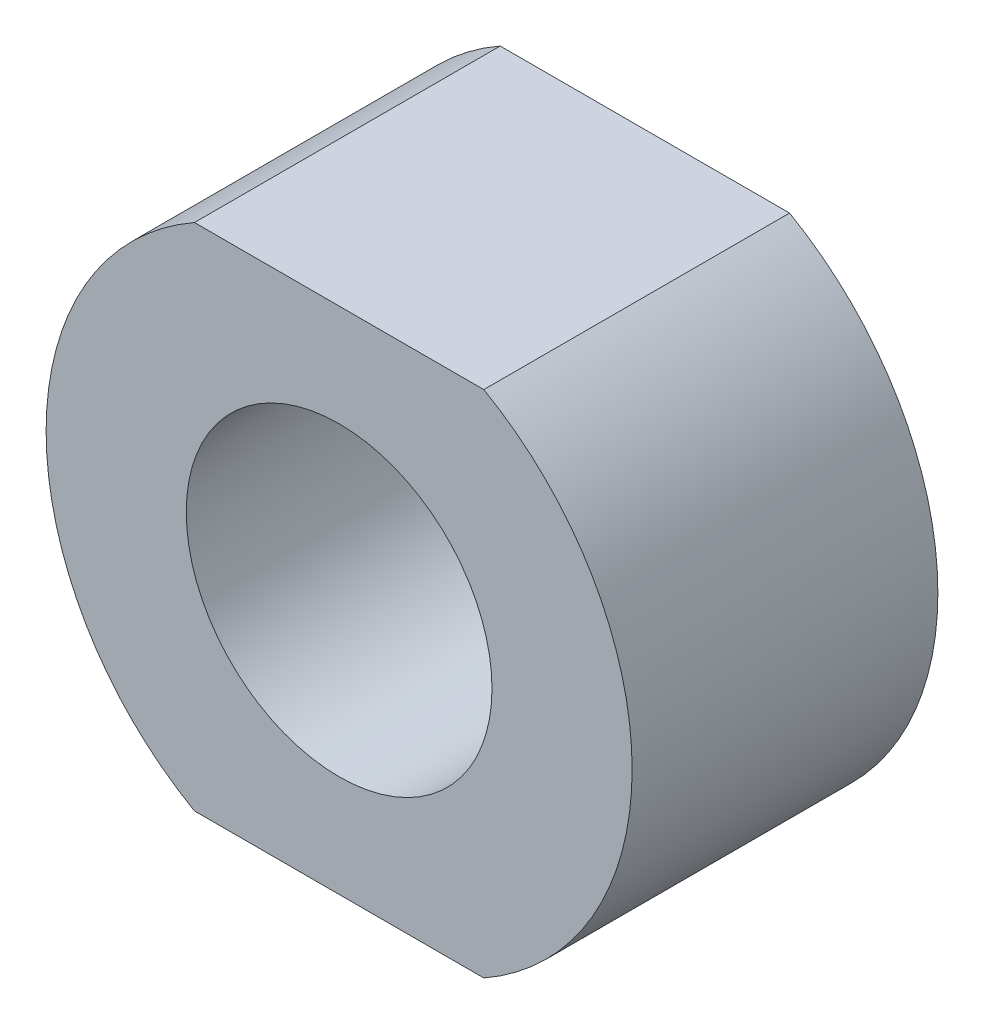
from build123d import *

# Parameters (mm, degrees)
ESQUISSE1_R             = 5.75
BOSS_EXTRU_1_DEPTH      = 6
ESQUISSE2_R             = 3
ENL_V_MAT_EXTRU_1_DEPTH = 6
ESQUISSE3_W             = 7.65295353
ESQUISSE3_H             = 1.132637123
ENL_V_MAT_EXTRU_2_DEPTH = 11.105691466


with BuildPart() as part:
    # Esquisse1 → Boss.-Extru.1 (new body)
    with BuildSketch(Plane.XY):
        Circle(ESQUISSE1_R)
    extrude(amount=BOSS_EXTRU_1_DEPTH)

    # Esquisse2 → Enlèv. mat.-Extru.1 (cut)
    with BuildSketch(Plane.XY.offset(6)):
        Circle(ESQUISSE2_R)
    extrude(amount=-ENL_V_MAT_EXTRU_1_DEPTH, mode=Mode.SUBTRACT)

    # Esquisse3 → Enlèv. mat.-Extru.2 (cut, through all)
    with BuildSketch(Plane.XY.offset(6)):
        with Locations((0, 5.566318562)):
            Rectangle(ESQUISSE3_W, ESQUISSE3_H)
        with Locations((0, -5.566318562)):
            Rectangle(ESQUISSE3_W, ESQUISSE3_H)
    extrude(amount=-ENL_V_MAT_EXTRU_2_DEPTH, mode=Mode.SUBTRACT)


solid = part.part
